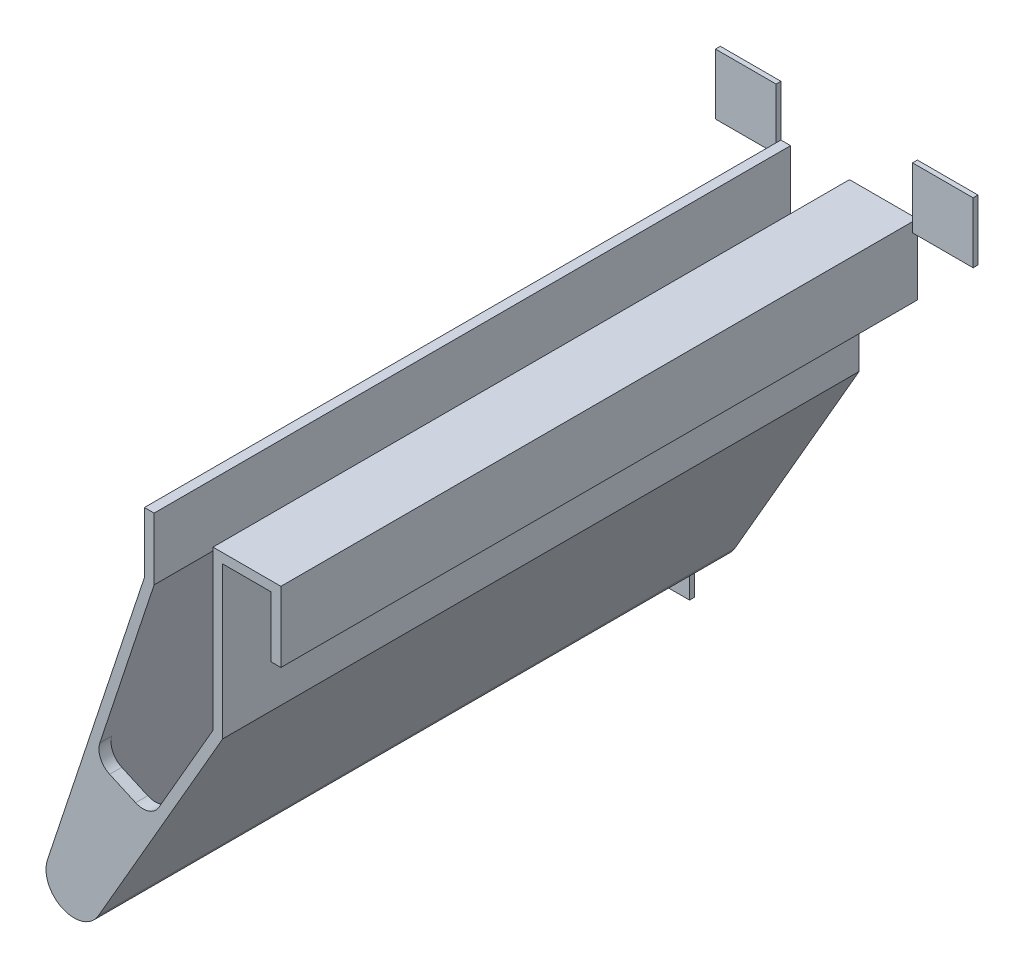
from build123d import *

# Parameters (mm, degrees)
BOSS_EXTRUDE1_DEPTH     = 105
BOSS_EXTRUDE2_DEPTH     = 2
FILLET1_R               = 3
CUT_EXTRUDE1_DEPTH      = 40
CUT_EXTRUDE1_DEPTH_BACK = 40
SKETCH4_W               = 10
SKETCH4_H               = 10
BOSS_EXTRUDE3_DEPTH     = 0.8


with BuildPart() as part:
    # Sketch1 → Boss-Extrude1 (new body)
    with BuildSketch(Plane.XY):
        with BuildLine():
            Line((0, 0), (0, 10))
            Line((0, 10), (-8, 10))
            Line((-8, 10), (-8, -15))
            Line((-8, -15), (-28.512191548, -50.528157935))
            ThreePointArc((-28.512191548, -50.528157935), (-34.418441215, -52.438299786), (-36.919980235, -46.757214542))
            Line((-36.919980235, -46.757214542), (-20.915152124, 1.6))
            Line((-20.915152124, 1.6), (-20.915152124, 11.6))
            Line((-20.915152124, 11.6), (-19.315152124, 11.6))
            Line((-19.315152124, 11.6), (-19.315152124, 1.342102465))
            Line((-19.315152124, 1.342102465), (-35.401013831, -47.259948135))
            ThreePointArc((-35.401013831, -47.259948135), (-33.763672062, -50.978410285), (-29.897832194, -49.728157935))
            Line((-29.897832194, -49.728157935), (-9.6, -14.571281292))
            Line((-9.6, -14.571281292), (-9.6, 11.6))
            Line((-9.6, 11.6), (1.6, 11.6))
            Line((1.6, 11.6), (1.6, 0))
            Line((1.6, 0), (0, 0))
        make_face()
    extrude(amount=BOSS_EXTRUDE1_DEPTH)

    # Sketch2 → Boss-Extrude2 (add)
    with BuildSketch(Plane(origin=(0, 0, 0), x_dir=(-1, 0, 0), z_dir=(0, 0, -1))):
        with BuildLine():
            Line((35.401013831, -47.259948135), (29.116843924, -28.272868091))
            Line((29.116843924, -28.272868091), (19.897832194, -32.407649859))
            Line((19.897832194, -32.407649859), (29.897832194, -49.728157935))
            ThreePointArc((29.897832194, -49.728157935), (33.763672062, -50.978410285), (35.401013831, -47.259948135))
        make_face()
    boss_extrude2 = extrude(amount=-BOSS_EXTRUDE2_DEPTH)

    # Mirror1: Boss-Extrude2 across plane
    add(boss_extrude2.mirror(Plane.XY.offset(52.5)))

    # Fillet1
    fillet1_edges = [part.edges().sort_by_distance(p)[0] for p in [
        (-19.897832194, -32.407649859, 1),
        (-29.116843924, -28.272868091, 1),
        (-29.116843924, -28.272868091, 104),
        (-19.897832194, -32.407649859, 104),
    ]]
    fillet(fillet1_edges, radius=FILLET1_R)

    # Sketch3 → Cut-Extrude1 (cut, two sides: drawn at the far end of the back side and taken through both)
    with BuildSketch(Plane.XY.offset(52.5).offset(-CUT_EXTRUDE1_DEPTH_BACK)):
        with BuildLine():
            Line((-32.143379325, -48.338130177), (-33.714421802, -53.084900187))
            ThreePointArc((-33.714421802, -53.084900187), (-34.219846801, -53.33895839), (-34.473905004, -52.833533391))
            Line((-34.473905004, -52.833533391), (-32.902862527, -48.08676338))
            ThreePointArc((-32.902862527, -48.08676338), (-32.397437528, -47.832705178), (-32.143379325, -48.338130177))
        make_face()
    extrude(amount=CUT_EXTRUDE1_DEPTH + CUT_EXTRUDE1_DEPTH_BACK, mode=Mode.SUBTRACT)

    # Sketch4 → Boss-Extrude3 (add)
    with BuildSketch(Plane(origin=(0, 0, 0), x_dir=(-1, 0, 0), z_dir=(0, 0, -1))):
        with Locations((-6.6, 15)):
            Rectangle(SKETCH4_W, SKETCH4_H)
        with Locations((25.915152124, 15)):
            Rectangle(SKETCH4_W, SKETCH4_H)
        with Locations((40.183119354, -55.872445207)):
            Rectangle(SKETCH4_W, SKETCH4_H)
    extrude(amount=-BOSS_EXTRUDE3_DEPTH)


solid = part.part
